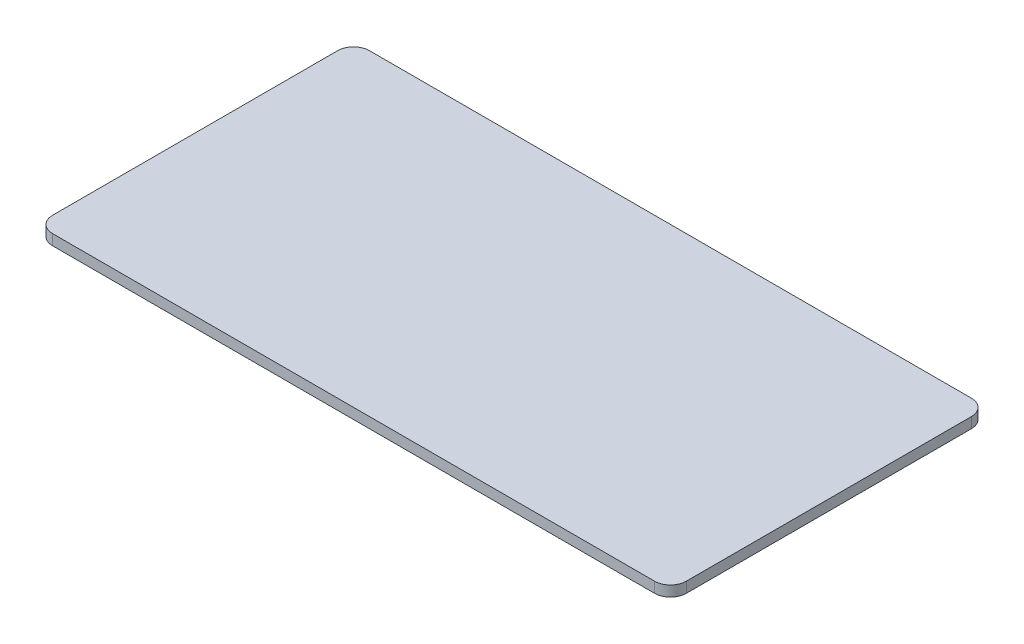
from build123d import *

# Parameters (mm, degrees)
SKETCH1_W           = 1200
SKETCH1_H           = 600
BOSS_EXTRUDE1_DEPTH = 20
FILLET1_R           = 30


with BuildPart() as part:
    # Sketch1 → Boss-Extrude1 (new body)
    with BuildSketch(Plane(origin=(0, 0, 0), x_dir=(1, 0, 0), z_dir=(0, 1, 0))):
        with Locations((86.02791913, -7.319748064)):
            Rectangle(SKETCH1_W, SKETCH1_H)
    extrude(amount=BOSS_EXTRUDE1_DEPTH)

    # Fillet1
    fillet1_edges = [part.edges().sort_by_distance(p)[0] for p in [
        (-513.97208087, 10, -292.680251936),
        (686.02791913, 10, -292.680251936),
        (686.02791913, 10, 307.319748064),
        (-513.97208087, 10, 307.319748064),
    ]]
    fillet(fillet1_edges, radius=FILLET1_R)


solid = part.part
